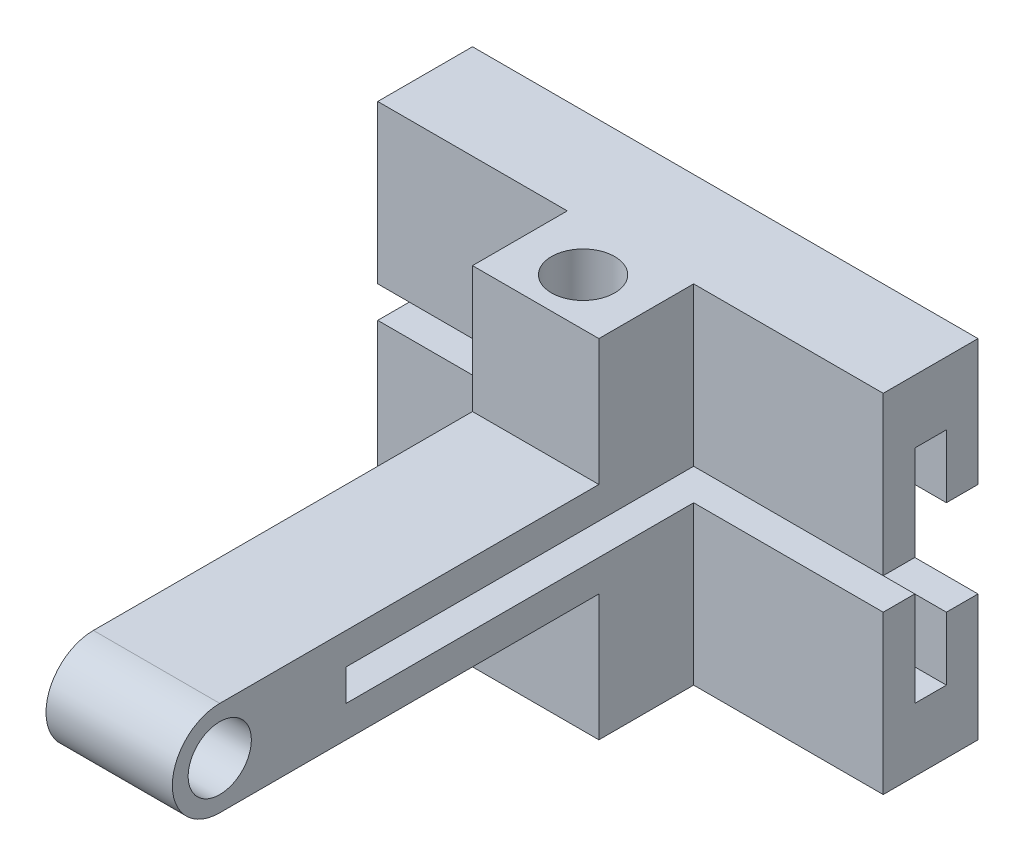
from build123d import *

# Parameters (mm, degrees)
SKETCH1_R               = 10
BOSS_EXTRUDE1_DEPTH     = 20
BOSS_EXTRUDE2_DEPTH     = 80
CUT_EXTRUDE1_DEPTH      = 226.610283454
CUT_EXTRUDE1_DEPTH_BACK = 226.610283454
SKETCH2_R               = 10


with BuildPart() as part:
    # Sketch1 → Boss-Extrude1 (new, symmetric)
    with BuildSketch(Plane.YZ):
        with BuildLine():
            Line((15, -120), (15, 0))
            ThreePointArc((15, 0), (0, 15), (-15, 0))
            Line((-15, 0), (-15, -120))
            Line((-15, -120), (-55, -120))
            Line((-55, -120), (-55, -150))
            Line((-55, -150), (-5, -150))
            Line((-5, -150), (-5, -40))
            Line((-5, -40), (5, -40))
            Line((5, -40), (5, -150))
            Line((5, -150), (55, -150))
            Line((55, -150), (55, -120))
            Line((55, -120), (15, -120))
        make_face()
        Circle(SKETCH1_R, mode=Mode.SUBTRACT)
    extrude(amount=BOSS_EXTRUDE1_DEPTH, both=True)

    # Sketch1<3> → Boss-Extrude2 (add, symmetric)
    with BuildSketch(Plane.YZ):
        Polygon((-5, -150), (-55, -150), (-55, -180), (-15, -180), (-15, -170), (-35, -170), (-35, -160), (-5, -160), align=None)
        Polygon((55, -180), (55, -150), (5, -150), (5, -160), (35, -160), (35, -170), (15, -170), (15, -180), align=None)
    extrude(amount=BOSS_EXTRUDE2_DEPTH, both=True)

    # Sketch2 → Cut-Extrude1 (cut, two sides: drawn at the far end of the back side and taken through both)
    with BuildSketch(Plane(origin=(0, 55, 0), x_dir=(-1, 0, 0), z_dir=(0, 1, 0)).offset(-CUT_EXTRUDE1_DEPTH_BACK)):
        with Locations((0, -135)):
            Circle(SKETCH2_R)
    extrude(amount=CUT_EXTRUDE1_DEPTH + CUT_EXTRUDE1_DEPTH_BACK, mode=Mode.SUBTRACT)


solid = part.part
